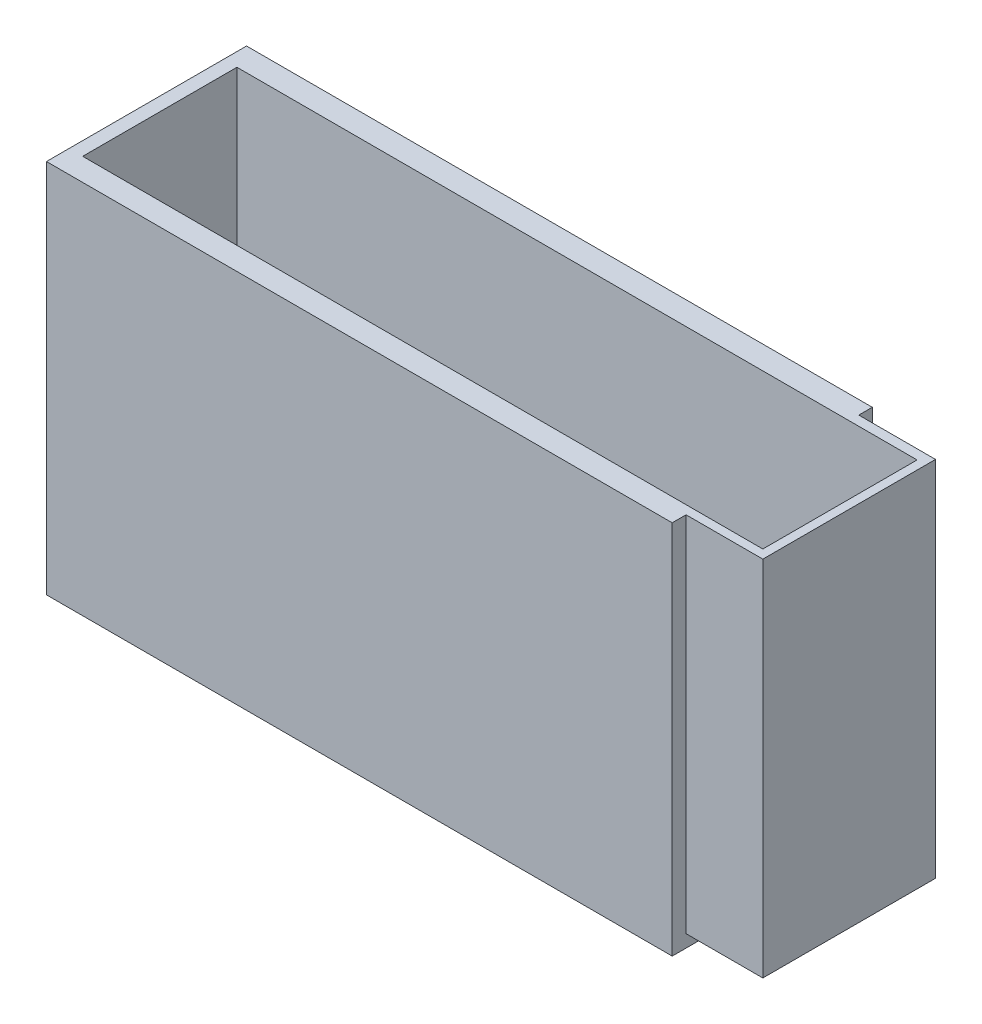
from build123d import *

# Parameters (mm, degrees)
SKETCH5_W           = 317.643030656
SKETCH5_H           = 101.565982789
BOSS_EXTRUDE3_DEPTH = 190.5
SKETCH11_W          = 310.281709158
SKETCH11_H          = 87.664375102
CUT_EXTRUDE2_DEPTH  = 184.15
SKETCH14_W          = 87.664375102
SKETCH14_H          = 184.15
BOSS_EXTRUDE5_DEPTH = 349.25
SKETCH18_W          = 345.261683736
SKETCH18_H          = 78.300417561
CUT_EXTRUDE3_DEPTH  = 181.61


with BuildPart() as part:
    # Sketch5 → Boss-Extrude3 (new body)
    with BuildSketch(Plane(origin=(0, 0, 0), x_dir=(1, 0, 0), z_dir=(0, 1, 0))):
        with Locations((-31.847605324, 64.703654394)):
            Rectangle(SKETCH5_W, SKETCH5_H)
    extrude(amount=BOSS_EXTRUDE3_DEPTH)

    # Sketch11 → Cut-Extrude2 (cut)
    with BuildSketch(Plane(origin=(0, 190.5, 0), x_dir=(1, 0, 0), z_dir=(0, 1, 0))):
        with Locations((-28.166944575, 64.789017072)):
            Rectangle(SKETCH11_W, SKETCH11_H)
    extrude(amount=-CUT_EXTRUDE2_DEPTH, mode=Mode.SUBTRACT)

    # Sketch14 → Boss-Extrude5 (add)
    with BuildSketch(Plane(origin=(-183.307799154, 0, 0), x_dir=(0, 0, -1), z_dir=(1, 0, 0))):
        with Locations((64.789017072, 98.425)):
            Rectangle(SKETCH14_W, SKETCH14_H)
    extrude(amount=BOSS_EXTRUDE5_DEPTH)

    # Sketch18 → Cut-Extrude3 (cut)
    with BuildSketch(Plane(origin=(0, 190.5, 0), x_dir=(1, 0, 0), z_dir=(0, 1, 0))):
        with Locations((-11.130382461, 64.549519714)):
            Rectangle(SKETCH18_W, SKETCH18_H)
    extrude(amount=-CUT_EXTRUDE3_DEPTH, mode=Mode.SUBTRACT)


solid = part.part
